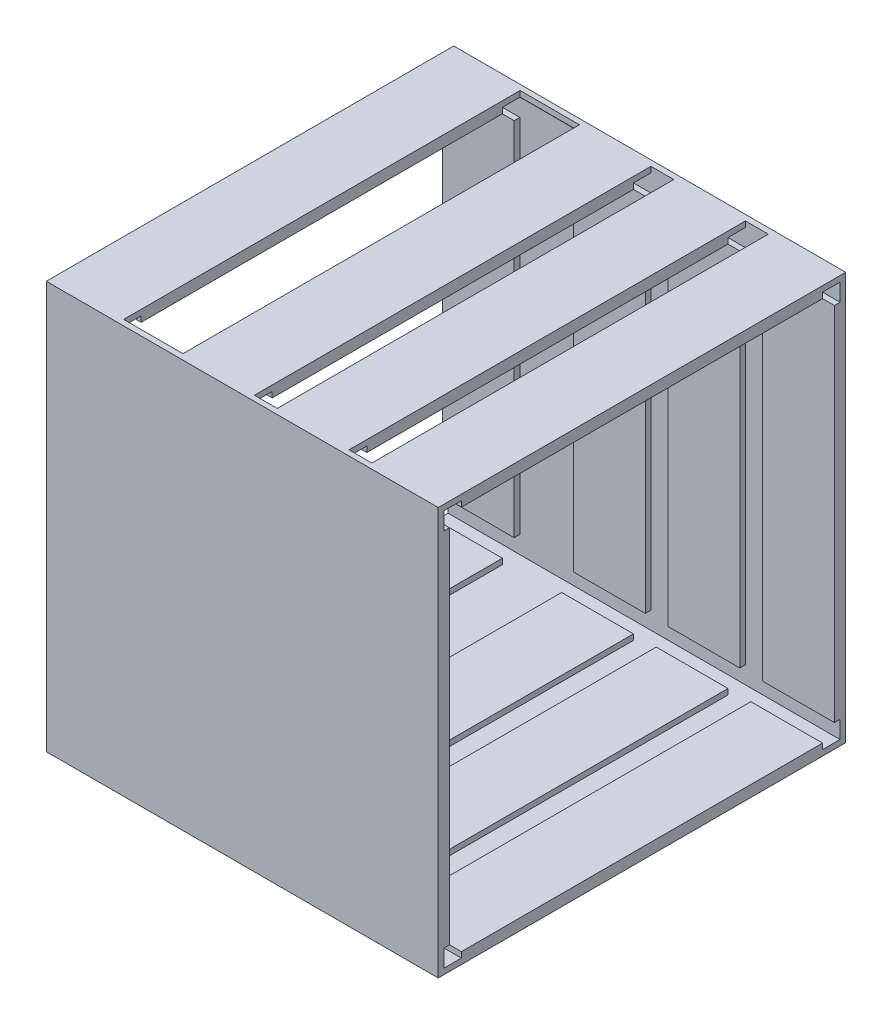
from build123d import *

# Parameters (mm, degrees)
SKETCH1_W            = 688.1
SKETCH1_H            = 688.1
SKETCH1_W_2          = 650
SKETCH1_H_2          = 650
BOSS_EXTRUDE1_DEPTH  = 661.9
SKETCH3_W            = 100.2
SKETCH3_H            = 650
SKETCH3_W_2          = 38.6
CUT_EXTRUDE1_DEPTH   = 9.525
SKETCH4_W            = 100.2
SKETCH4_H            = 669.5
SKETCH4_W_2          = 38.6
SKETCH4_H_2          = 669.05
CUT_EXTRUDE3_DEPTH   = 9.525
SKETCH6_W            = 100.2
SKETCH6_H            = 669.5
SKETCH6_W_2          = 38.6
CUT_EXTRUDE4_DEPTH   = 9.525
CUT_EXTRUDE5_DEPTH   = 700
MIRROR6_COPY_1_DEPTH = 700


with BuildPart() as part:
    # Sketch1 → Boss-Extrude1 (new body)
    with BuildSketch(Plane(origin=(0, 0, 0), x_dir=(0, 0, -1), z_dir=(1, 0, 0))):
        with Locations((344.05, 344.05)):
            Rectangle(SKETCH1_W, SKETCH1_H)
        with Locations((344.05, 344.05)):
            Rectangle(SKETCH1_W_2, SKETCH1_H_2, mode=Mode.SUBTRACT)
    extrude(amount=BOSS_EXTRUDE1_DEPTH)

    # Sketch3 → Cut-Extrude1 (cut)
    with BuildSketch(Plane.XY.offset(-669.05)):
        with Locations((171.225, 344.05)):
            Rectangle(SKETCH3_W, SKETCH3_H)
        with Locations((361.75, 344.05)):
            Rectangle(SKETCH3_W_2, SKETCH3_H)
        with Locations((521.475, 344.05)):
            Rectangle(SKETCH3_W_2, SKETCH3_H)
    cut_extrude1 = extrude(amount=-CUT_EXTRUDE1_DEPTH, mode=Mode.SUBTRACT)

    # Mirror2: Cut-Extrude1 across plane
    add(cut_extrude1.mirror(Plane(origin=(0, 0, -344.05), x_dir=(1, 0, 0), z_dir=(0, 0, -1))), mode=Mode.SUBTRACT)

    # Sketch4 → Cut-Extrude3 (cut)
    with BuildSketch(Plane(origin=(0, 19.05, 0), x_dir=(1, 0, 0), z_dir=(0, 1, 0))):
        with Locations((171.225, 343.825)):
            Rectangle(SKETCH4_W, SKETCH4_H)
        with Locations((361.75, 343.825)):
            Rectangle(SKETCH4_W_2, SKETCH4_H)
        with Locations((521.475, 344.05)):
            Rectangle(SKETCH4_W_2, SKETCH4_H_2)
    cut_extrude3 = extrude(amount=-CUT_EXTRUDE3_DEPTH, mode=Mode.SUBTRACT)

    # Mirror4: Cut-Extrude3 across plane
    add(cut_extrude3.mirror(Plane.ZX.offset(344.05)), mode=Mode.SUBTRACT)

    # Sketch6 → Cut-Extrude4 (cut)
    with BuildSketch(Plane(origin=(0, 688.1, 0), x_dir=(1, 0, 0), z_dir=(0, 1, 0))):
        with Locations((171.225, 344.275)):
            Rectangle(SKETCH6_W, SKETCH6_H)
        with Locations((361.75, 343.825)):
            Rectangle(SKETCH6_W_2, SKETCH6_H)
        with Locations((521.475, 343.825)):
            Rectangle(SKETCH6_W_2, SKETCH6_H)
    extrude(amount=-CUT_EXTRUDE4_DEPTH, mode=Mode.SUBTRACT)

    # Sketch7 → Cut-Extrude5 (cut)
    with BuildSketch(Plane.ZY):
        Polygon((-19.05, 39.05), (-9.525, 39.05), (-9.525, 9.525), (-39.05, 9.525), (-39.05, 19.05), (-19.05, 19.05), align=None)
    cut_extrude5 = extrude(amount=-CUT_EXTRUDE5_DEPTH, mode=Mode.SUBTRACT)

    # Mirror5: Cut-Extrude5 across plane
    add(cut_extrude5.mirror(Plane(origin=(0, 0, -344.05), x_dir=(1, 0, 0), z_dir=(0, 0, -1))), mode=Mode.SUBTRACT)

    # Mirror6: Cut-Extrude5 across plane
    add(cut_extrude5.mirror(Plane.ZX.offset(344.05)), mode=Mode.SUBTRACT)

    # Mirror6 copy 1 sketch → Mirror6 copy 1 (cut)
    with BuildSketch(Plane(origin=(0, 688.1, -688.1), x_dir=(0, 0, -1), z_dir=(-1, 0, 0))):
        Polygon((-19.05, 39.05), (-9.525, 39.05), (-9.525, 9.525), (-39.05, 9.525), (-39.05, 19.05), (-19.05, 19.05), align=None)
    extrude(amount=-MIRROR6_COPY_1_DEPTH, mode=Mode.SUBTRACT)


solid = part.part
